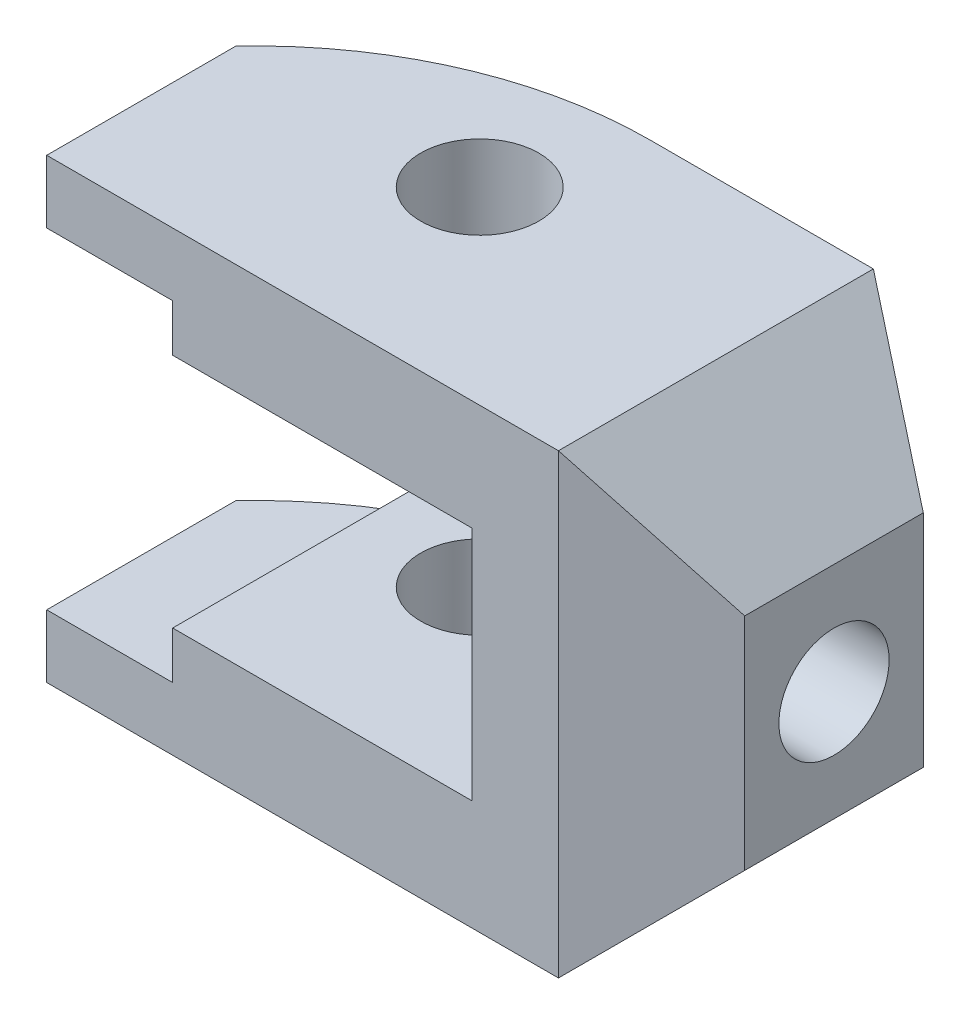
from build123d import *

# Parameters (mm, degrees)
ESQUISSE1_R             = 7.5
BOSS_EXTRU_1_DEPTH      = 58
ESQUISSE2_W             = 54
ESQUISSE2_H             = 30
ENL_V_MAT_EXTRU_1_DEPTH = 107.60206377
ESQUISSE3_W             = 16
ESQUISSE3_H             = 42
ENL_V_MAT_EXTRU_2_DEPTH = 107.60206377
ENL_V_MAT_EXTRU_4_DEPTH = 107.60206377
ESQUISSE6_R             = 7
ENL_V_MAT_EXTRU_6_DEPTH = 107.60206377


with BuildPart() as part:
    # Esquisse1 → Boss.-Extru.1 (new body)
    with BuildSketch(Plane(origin=(0, 0, 0), x_dir=(1, 0, 0), z_dir=(0, 1, 0))):
        with BuildLine():
            Line((0, 0), (65, 0))
            Line((65, 0), (80, 8.660254038))
            Line((80, 8.660254038), (80, 31.339745962))
            Line((80, 31.339745962), (65, 40))
            Line((65, 40), (36.66060556, 40))
            ThreePointArc((36.66060556, 40), (16.66060556, 35.82575695), (0, 24))
            Line((0, 24), (0, 0))
        make_face()
        with Locations(Location((31, 24, 0), (0, 0, 90))):
            Circle(ESQUISSE1_R, mode=Mode.SUBTRACT)
    extrude(amount=BOSS_EXTRU_1_DEPTH)

    # Esquisse2 → Enlèv. mat.-Extru.1 (cut, through all)
    with BuildSketch(Plane.XY):
        with Locations((27, 29)):
            Rectangle(ESQUISSE2_W, ESQUISSE2_H)
    extrude(amount=-ENL_V_MAT_EXTRU_1_DEPTH, mode=Mode.SUBTRACT)

    # Esquisse3 → Enlèv. mat.-Extru.2 (cut, through all)
    with BuildSketch(Plane.XY):
        with Locations((8, 29)):
            Rectangle(ESQUISSE3_W, ESQUISSE3_H)
    extrude(amount=-ENL_V_MAT_EXTRU_2_DEPTH, mode=Mode.SUBTRACT)

    # Esquisse5 → Enlèv. mat.-Extru.4 (cut, through all)
    with BuildSketch(Plane(origin=(0, 0, -40), x_dir=(-1, 0, 0), z_dir=(0, 0, -1))):
        Polygon((-65, 58), (-80, 58), (-80, 43), align=None)
        Polygon((-65, 0), (-80, 0), (-80, 15), align=None)
    extrude(amount=-ENL_V_MAT_EXTRU_4_DEPTH, mode=Mode.SUBTRACT)

    # Esquisse6 → Enlèv. mat.-Extru.6 (cut, through all)
    with BuildSketch(Plane(origin=(80, 0, 0), x_dir=(0, 0, -1), z_dir=(1, 0, 0))):
        with Locations((20, 29)):
            Circle(ESQUISSE6_R)
    extrude(amount=-ENL_V_MAT_EXTRU_6_DEPTH, mode=Mode.SUBTRACT)


solid = part.part
